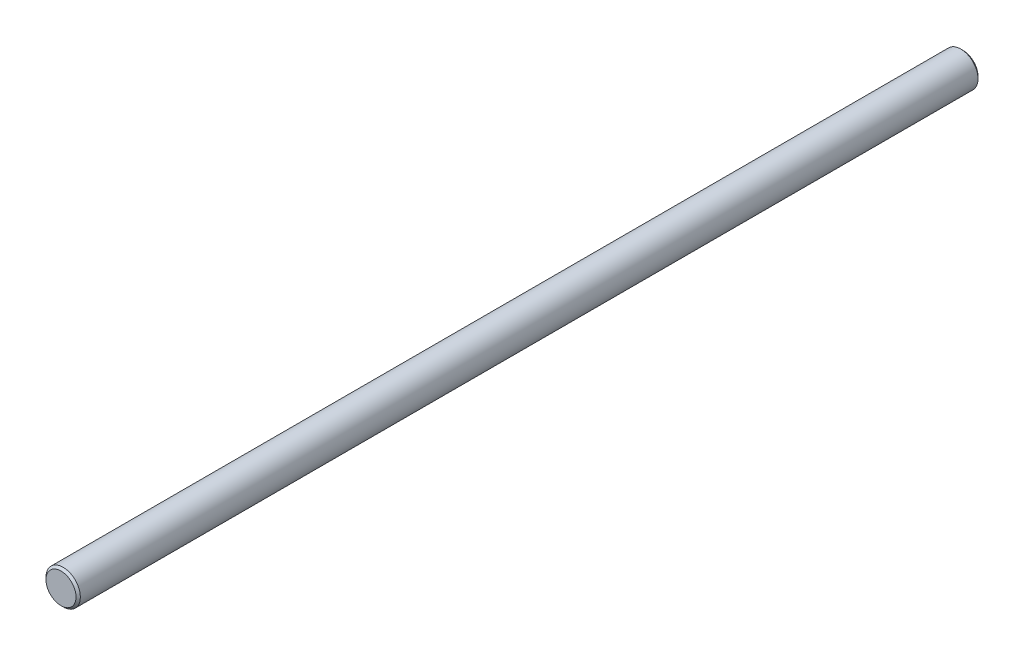
from build123d import *

# Parameters (mm, degrees)
SKETCH1_R           = 8
BOSS_EXTRUDE1_DEPTH = 210
CHAMFER1_SIZE       = 1


with BuildPart() as part:
    # Sketch1 → Boss-Extrude1 (new, symmetric)
    with BuildSketch(Plane.XY):
        Circle(SKETCH1_R)
    extrude(amount=BOSS_EXTRUDE1_DEPTH, both=True)

    # Chamfer1
    chamfer1_edges = [part.edges().sort_by_distance(p)[0] for p in [
        (-8, 0, -210),
        (-8, 0, 210),
    ]]
    chamfer(chamfer1_edges, length=CHAMFER1_SIZE)


solid = part.part
